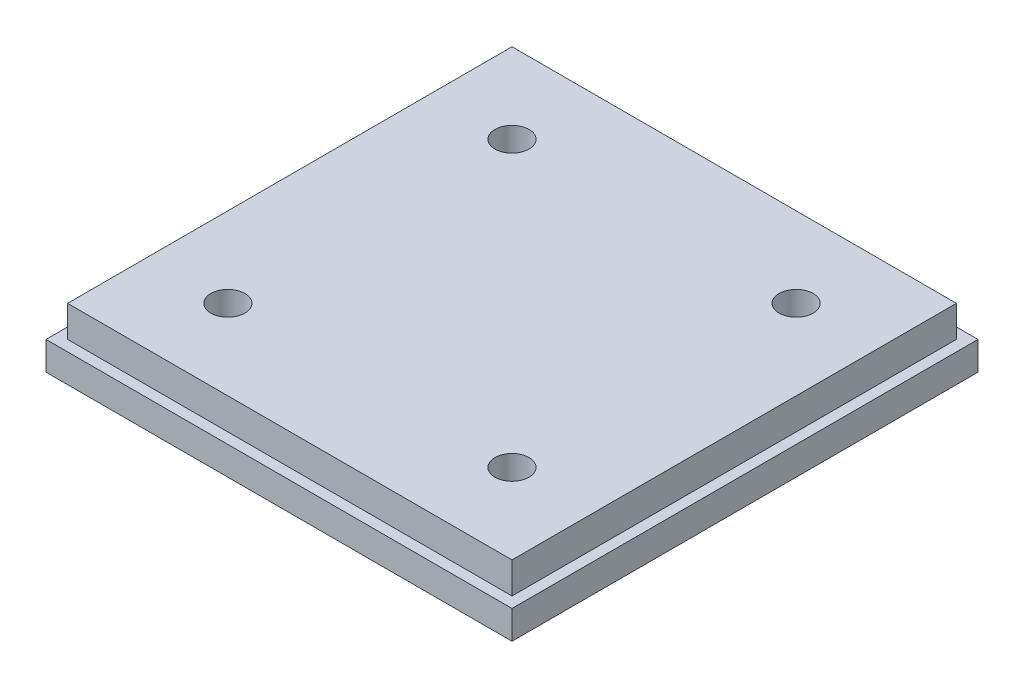
from build123d import *

# Parameters (mm, degrees)
SKETCH1_W           = 82
SKETCH1_H           = 82
BOSS_EXTRUDE1_DEPTH = 5
SKETCH2_W           = 78.2
SKETCH2_H           = 78.2
BOSS_EXTRUDE2_DEPTH = 5.5
SKETCH3_R           = 3
CUT_EXTRUDE1_DEPTH  = 8


with BuildPart() as part:
    # Sketch1 → Boss-Extrude1 (new body)
    with BuildSketch(Plane(origin=(0, 0, 0), x_dir=(1, 0, 0), z_dir=(0, 1, 0))):
        Rectangle(SKETCH1_W, SKETCH1_H)
    extrude(amount=BOSS_EXTRUDE1_DEPTH)

    # Sketch2 → Boss-Extrude2 (add)
    with BuildSketch(Plane(origin=(0, 5, 0), x_dir=(1, 0, 0), z_dir=(0, 1, 0))):
        Rectangle(SKETCH2_W, SKETCH2_H)
    extrude(amount=BOSS_EXTRUDE2_DEPTH)

    # Sketch3 → Cut-Extrude1 (cut)
    with BuildSketch(Plane(origin=(0, 10.5, 0), x_dir=(1, 0, 0), z_dir=(0, 1, 0))):
        with Locations(Location((-25, 25, 0), (0, 0, 270))):
            Circle(SKETCH3_R)
        with Locations(Location((-25, -25, 0), (0, 0, 90))):
            Circle(SKETCH3_R)
        with Locations(Location((25, -25, 0), (0, 0, 270))):
            Circle(SKETCH3_R)
        with Locations(Location((25, 25, 0), (0, 0, 90))):
            Circle(SKETCH3_R)
    extrude(amount=-CUT_EXTRUDE1_DEPTH, mode=Mode.SUBTRACT)


solid = part.part
